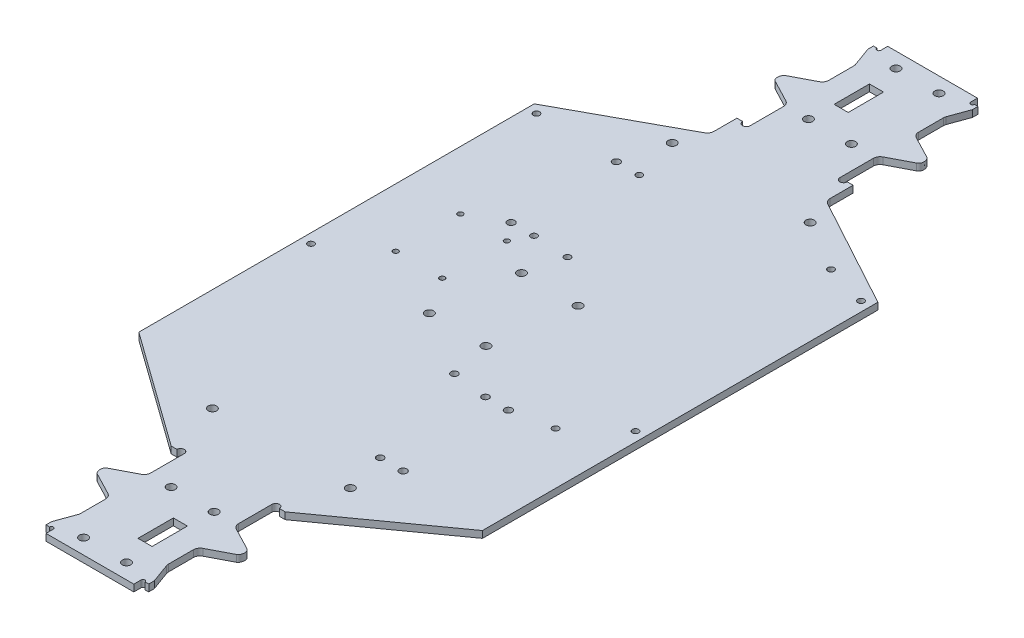
from build123d import *

# Parameters (mm, degrees)
BOSS_EXTRUDE1_DEPTH = 3.175
SKETCH3_R           = 1.9685
SKETCH3_R_2         = 1.7018
SKETCH3_R_3         = 1.4605
SKETCH3_R_4         = 1.5875
SKETCH3_R_5         = 1.4732
SKETCH3_R_6         = 1.2065
SKETCH3_W           = 6.5532
SKETCH3_H           = 16.4592
CUT_EXTRUDE1_DEPTH  = 365.434389894


with BuildPart() as part:
    # Sketch1 → Boss-Extrude1 (new body)
    with BuildSketch(Plane(origin=(0, 0, 0), x_dir=(1, 0, 0), z_dir=(0, 1, 0))):
        with BuildLine():
            Line((20.9042, 21.057301381), (20.9042, 9.500301381))
            ThreePointArc((20.9042, 9.500301381), (21.364503799, 7.853774874), (22.611947739, 6.684667206))
            Line((22.611947739, 6.684667206), (32.903843319, 1.321467969))
            add(Edge.make_bspline(
                [(32.903843319, 1.321467969), (33.614873553, 0.950943726), (34.463414094, -1.137550566), (33.907098259, -2.92148302), (32.903843319, -3.444288181)],
                knots=[0, 0, 0, 0, 0.5, 1, 1, 1, 1], degree=3))
            Line((32.903843319, -3.444288181), (22.611947739, -8.807487419))
            ThreePointArc((22.611947739, -8.807487419), (21.364503799, -9.976595087), (20.9042, -11.623121593))
            Line((20.9042, -11.623121593), (20.9042, -27.172610106))
            ThreePointArc((20.9042, -27.172610106), (22.6441, -28.912510106), (24.384, -27.172610106))
            Line((24.384, -27.172610106), (27.051, -27.172610106))
            Line((27.051, -27.172610106), (27.051, -37.859834638))
            ThreePointArc((27.051, -37.859834638), (27.496194931, -39.48118879), (28.706930259, -40.647854028))
            Line((28.706930259, -40.647854028), (80.01, -68.600651316))
            Line((80.01, -68.600651316), (80.01, -252.750651316))
            Line((80.01, -252.750651316), (26.5303, -291.142539353))
            Line((26.5303, -291.142539353), (23.8379, -291.142539353))
            ThreePointArc((23.8379, -291.142539353), (22.1361, -289.440739353), (20.4343, -291.142539353))
            Line((20.4343, -291.142539353), (20.4343, -306.692027866))
            ThreePointArc((20.4343, -306.692027866), (20.894603799, -308.338554372), (22.142047739, -309.50766204))
            Line((22.142047739, -309.50766204), (32.433943319, -314.870861278))
            add(Edge.make_bspline(
                [(32.433943319, -319.63661747), (33.144973553, -319.266093228), (33.993514113, -317.177598915), (33.437198259, -315.393666439), (32.433943319, -314.870861278)],
                knots=[0, 0, 0, 0, 0.5, 1, 1, 1, 1], degree=3))
            Line((32.433943319, -319.63661747), (22.142047738, -324.999816708))
            ThreePointArc((22.142047738, -324.999816708), (20.894603798, -326.168924376), (20.434299999, -327.815450882))
            Line((20.434299999, -327.815450882), (20.434299999, -339.372450882))
            ThreePointArc((20.434299999, -339.372450882), (20.482218455, -339.921983425), (20.62452741, -340.454928408))
            Line((20.62452741, -340.454928408), (23.888699999, -349.455404296))
            Line((23.888699999, -349.455404296), (23.88337128, -351.995398706))
            Line((23.88337128, -351.995398706), (22.237699999, -352.127939395))
            ThreePointArc((22.237699999, -352.127939395), (21.248038856, -351.230539971), (20.451461278, -352.303022636))
            Line((20.451461278, -352.303022636), (20.451461278, -355.528822636))
            Line((20.451461278, -355.528822636), (-20.451461278, -355.528822636))
            Line((-20.451461278, -355.528822636), (-20.451461278, -352.303022636))
            ThreePointArc((-20.451461278, -352.303022636), (-21.248038856, -351.230539971), (-22.237699999, -352.127939395))
            Line((-22.237699999, -352.127939395), (-23.88337128, -351.995398706))
            Line((-23.88337128, -351.995398706), (-23.888699999, -349.455404296))
            Line((-23.888699999, -349.455404296), (-20.62452741, -340.454928408))
            ThreePointArc((-20.62452741, -340.454928408), (-20.482218455, -339.921983425), (-20.434299999, -339.372450882))
            Line((-20.434299999, -339.372450882), (-20.434299999, -327.815450882))
            ThreePointArc((-20.434299999, -327.815450882), (-20.894603798, -326.168924376), (-22.142047738, -324.999816708))
            Line((-22.142047738, -324.999816708), (-32.433943319, -319.63661747))
            add(Edge.make_bspline(
                [(-32.433943319, -319.63661747), (-33.144973553, -319.266093228), (-33.993514113, -317.177598915), (-33.437198259, -315.393666439), (-32.433943319, -314.870861278)],
                knots=[0, 0, 0, 0, 0.5, 1, 1, 1, 1], degree=3))
            Line((-32.433943319, -314.870861278), (-22.142047739, -309.50766204))
            ThreePointArc((-22.142047739, -309.50766204), (-20.894603799, -308.338554372), (-20.4343, -306.692027866))
            Line((-20.4343, -306.692027866), (-20.4343, -291.142539353))
            ThreePointArc((-20.4343, -291.142539353), (-22.1361, -289.440739353), (-23.8379, -291.142539353))
            Line((-23.8379, -291.142539353), (-26.5303, -291.142539353))
            Line((-26.5303, -291.142539353), (-80.01, -252.750651316))
            Line((-80.01, -252.750651316), (-80.01, -68.600651316))
            Line((-80.01, -68.600651316), (-28.706930259, -40.647854028))
            ThreePointArc((-28.706930259, -40.647854028), (-27.496194931, -39.48118879), (-27.051, -37.859834638))
            Line((-27.051, -37.859834638), (-27.051, -27.172610106))
            Line((-27.051, -27.172610106), (-24.384, -27.172610106))
            ThreePointArc((-24.384, -27.172610106), (-22.6441, -28.912510106), (-20.9042, -27.172610106))
            Line((-20.9042, -27.172610106), (-20.9042, -11.623121593))
            ThreePointArc((-20.9042, -11.623121593), (-21.364503799, -9.976595087), (-22.611947739, -8.807487419))
            Line((-22.611947739, -8.807487419), (-32.903843319, -3.444288181))
            add(Edge.make_bspline(
                [(-32.903843319, 1.321467969), (-33.614873553, 0.950943726), (-34.463414094, -1.137550566), (-33.907098259, -2.92148302), (-32.903843319, -3.444288181)],
                knots=[0, 0, 0, 0, 0.5, 1, 1, 1, 1], degree=3))
            Line((-32.903843319, 1.321467969), (-22.611947739, 6.684667206))
            ThreePointArc((-22.611947739, 6.684667206), (-21.364503799, 7.853774874), (-20.9042, 9.500301381))
            Line((-20.9042, 9.500301381), (-20.9042, 21.057301381))
            ThreePointArc((-20.9042, 21.057301381), (-20.952118456, 21.606833923), (-21.094427411, 22.139778906))
            Line((-21.094427411, 22.139778906), (-24.3586, 31.140254794))
            Line((-24.3586, 31.140254794), (-24.3586, 33.680254794))
            Line((-24.3586, 33.680254794), (-22.7076, 33.680254794))
            ThreePointArc((-22.7076, 33.680254794), (-21.8059, 32.778554794), (-20.9042, 33.680254794))
            Line((-20.9042, 33.680254794), (-20.9042, 36.906054794))
            Line((-20.9042, 36.906054794), (20.9042, 36.906054794))
            Line((20.9042, 36.906054794), (20.9042, 33.680254794))
            ThreePointArc((20.9042, 33.680254794), (21.8059, 32.778554794), (22.7076, 33.680254794))
            Line((22.7076, 33.680254794), (24.3586, 33.680254794))
            Line((24.3586, 33.680254794), (24.3586, 31.140254794))
            Line((24.3586, 31.140254794), (21.094427411, 22.139778906))
            ThreePointArc((21.094427411, 22.139778906), (20.952118456, 21.606833923), (20.9042, 21.057301381))
        make_face()
    extrude(amount=BOSS_EXTRUDE1_DEPTH)

    # Sketch3 → Cut-Extrude1 (cut, through all)
    with BuildSketch(Plane(origin=(0, 3.175, 0), x_dir=(1, 0, 0), z_dir=(0, 1, 0))):
        with Locations(Location((-10.0076, 29.870254794, 0), (0, 0, 270))):
            Circle(SKETCH3_R)
        with Locations(Location((10.0076, 29.870254794, 0), (0, 0, 270))):
            Circle(SKETCH3_R)
        with Locations(Location((-10.0076, -10.922145206, 0), (0, 0, 270))):
            Circle(SKETCH3_R)
        with Locations(Location((10.0076, -10.922145206, 0), (0, 0, 270))):
            Circle(SKETCH3_R)
        with Locations(Location((-32.1183, -52.241120441, 0), (0, 0, 270))):
            Circle(SKETCH3_R)
        with Locations(Location((32.1183, -52.241120441, 0), (0, 0, 270))):
            Circle(SKETCH3_R)
        with Locations(Location((-10.0076, -348.493022636, 0), (0, 0, 270))):
            Circle(SKETCH3_R)
        with Locations(Location((10.0076, -348.493022636, 0), (0, 0, 270))):
            Circle(SKETCH3_R)
        with Locations(Location((10.0076, -307.700622636, 0), (0, 0, 270))):
            Circle(SKETCH3_R)
        with Locations(Location((-10.0076, -307.700622636, 0), (0, 0, 270))):
            Circle(SKETCH3_R)
        with Locations(Location((-32.1183, -266.3816474, 0), (0, 0, 270))):
            Circle(SKETCH3_R)
        with Locations(Location((32.1183, -266.3816474, 0), (0, 0, 270))):
            Circle(SKETCH3_R)
        with Locations(Location((-37.528295893, -72.840452684, 0), (0, 0, 270))):
            Circle(SKETCH3_R_2)
        with Locations(Location((-26.860295893, -72.840452684, 0), (0, 0, 270))):
            Circle(SKETCH3_R_3)
        with Locations(Location((-26.860295893, -121.862452684, 0), (0, 0, 270))):
            Circle(SKETCH3_R_3)
        with Locations(Location((-37.528295893, -121.862452684, 0), (0, 0, 270))):
            Circle(SKETCH3_R_2)
        with Locations(Location((37.528295893, -247.200539353, 0), (0, 0, 270))):
            Circle(SKETCH3_R_2)
        with Locations(Location((26.860295893, -247.200539353, 0), (0, 0, 270))):
            Circle(SKETCH3_R_4)
        with Locations(Location((37.528295893, -198.178539353, 0), (0, 0, 270))):
            Circle(SKETCH3_R_2)
        with Locations(Location((26.860295893, -198.178539353, 0), (0, 0, 270))):
            Circle(SKETCH3_R_4)
        with Locations(Location((-10.454374971, -122.659657412, 0), (0, 0, 270))):
            Circle(SKETCH3_R_3)
        with Locations(Location((10.232107284, -196.03685562, 0), (0, 0, 270))):
            Circle(SKETCH3_R_4)
        with Locations(Location((-14.730817565, -139.82308431, 0), (0, 0, 270))):
            Circle(SKETCH3_R)
        with Locations(Location((11.634382435, -139.82308431, 0), (0, 0, 270))):
            Circle(SKETCH3_R)
        with Locations(Location((6.392231086, -177.483796141, 0), (0, 0, 270))):
            Circle(SKETCH3_R)
        with Locations(Location((-19.972968914, -177.483796141, 0), (0, 0, 270))):
            Circle(SKETCH3_R)
        with Locations(Location((75.565, -72.007264101, 0), (0, 0, 270))):
            Circle(SKETCH3_R_3)
        with Locations(Location((-75.565, -72.007264101, 0), (0, 0, 270))):
            Circle(SKETCH3_R_3)
        with Locations(Location((-75.565, -177.036264101, 0), (0, 0, 270))):
            Circle(SKETCH3_R_3)
        with Locations(Location((75.565, -177.036264101, 0), (0, 0, 270))):
            Circle(SKETCH3_R_3)
        with Locations(Location((55.88, -66.293261749, 0), (0, 0, 270))):
            Circle(SKETCH3_R_5)
        with Locations(Location((55.88, -194.563261749, 0), (0, 0, 270))):
            Circle(SKETCH3_R_5)
        with Locations(Location((-52.798120074, -130.238088074, 0), (0, 0, 270))):
            Circle(SKETCH3_R_6)
        with Locations(Location((-31.106520074, -130.238088074, 0), (0, 0, 270))):
            Circle(SKETCH3_R_6)
        with Locations(Location((-52.798120074, -160.337088074, 0), (0, 0, 270))):
            Circle(SKETCH3_R_6)
        with Locations(Location((-31.106520074, -160.337088074, 0), (0, 0, 270))):
            Circle(SKETCH3_R_6)
        with Locations((-6.7056, 9.245454794)):
            Rectangle(SKETCH3_W, SKETCH3_H)
        with Locations((6.235699999, -327.868222636)):
            Rectangle(SKETCH3_W, SKETCH3_H)
    extrude(amount=-CUT_EXTRUDE1_DEPTH, mode=Mode.SUBTRACT)


solid = part.part
